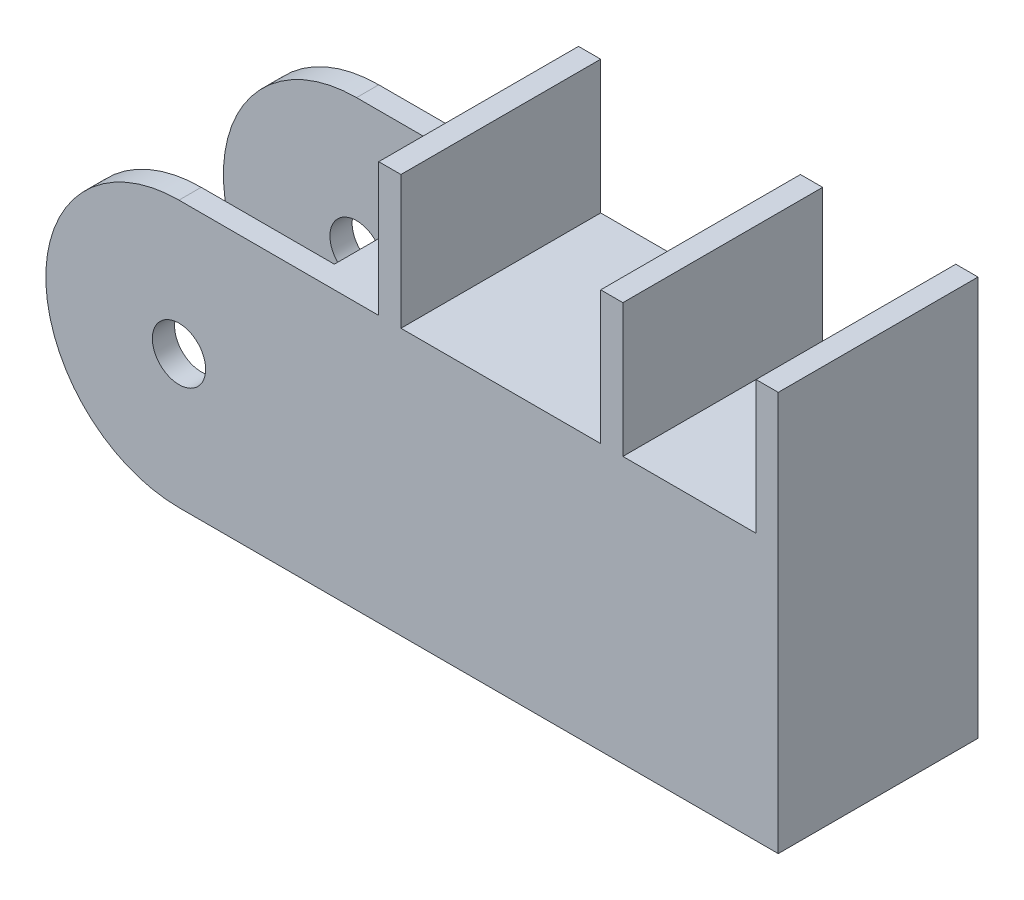
from build123d import *

# Parameters (mm, degrees)
DODANIE_WYCI_GNI_CIE1_DEPTH = 5
SZKIC2_W                    = 100
SZKIC2_H                    = 35
DODANIE_WYCI_GNI_CIE2_DEPTH = 5
SZKIC3_R                    = 6
WYTNIJ_WYCI_GNI_CIE1_DEPTH  = 110.316055545
SZKIC4_W                    = 5
SZKIC4_H                    = 30
SZKIC4_H_2                  = 90
DODANIE_WYCI_GNI_CIE3_DEPTH = 45


with BuildPart() as part:
    # Szkic1 → Dodanie-wyciągnięcie1 (new body)
    with BuildSketch(Plane.XY):
        with BuildLine():
            Line((-65, -30), (65, -30))
            Line((65, -30), (65, 30))
            Line((65, 30), (-65, 30))
            ThreePointArc((-65, 30), (-95, 0), (-65, -30))
        make_face()
    extrude(amount=DODANIE_WYCI_GNI_CIE1_DEPTH)


with BuildPart() as body_2:
    # Lustro2: mirrored copy
    add(part.part.mirror(Plane.XY.offset(22.5)))


with BuildPart() as part_1:
    add(part.part)

    add(body_2.part)  # Dodanie-wyciągnięcie2 merges body 2
    # Szkic2 → Dodanie-wyciągnięcie2 (add)
    with BuildSketch(Plane(origin=(0, 30, 0), x_dir=(1, 0, 0), z_dir=(0, 1, 0))):
        with Locations((15, -22.5)):
            Rectangle(SZKIC2_W, SZKIC2_H)
    dodanie_wyci_gni_cie2 = extrude(amount=-DODANIE_WYCI_GNI_CIE2_DEPTH)

    # Lustro3: Dodanie-wyciągnięcie2 across plane
    add(dodanie_wyci_gni_cie2.mirror(Plane.ZX))

    # Szkic3 → Wytnij-wyciągnięcie1 (cut, through all)
    with BuildSketch(Plane.XY.offset(45)):
        with Locations((-65, 0)):
            Circle(SZKIC3_R)
    extrude(amount=-WYTNIJ_WYCI_GNI_CIE1_DEPTH, mode=Mode.SUBTRACT)

    # Szkic4 → Dodanie-wyciągnięcie3 (add)
    with BuildSketch(Plane.XY.offset(45)):
        with Locations((32.5, 45)):
            Rectangle(SZKIC4_W, SZKIC4_H)
        with Locations((67.5, 15)):
            Rectangle(SZKIC4_W, SZKIC4_H_2)
        with Locations((-17.5, 45)):
            Rectangle(SZKIC4_W, SZKIC4_H)
    extrude(amount=-DODANIE_WYCI_GNI_CIE3_DEPTH)


solid = part_1.part
